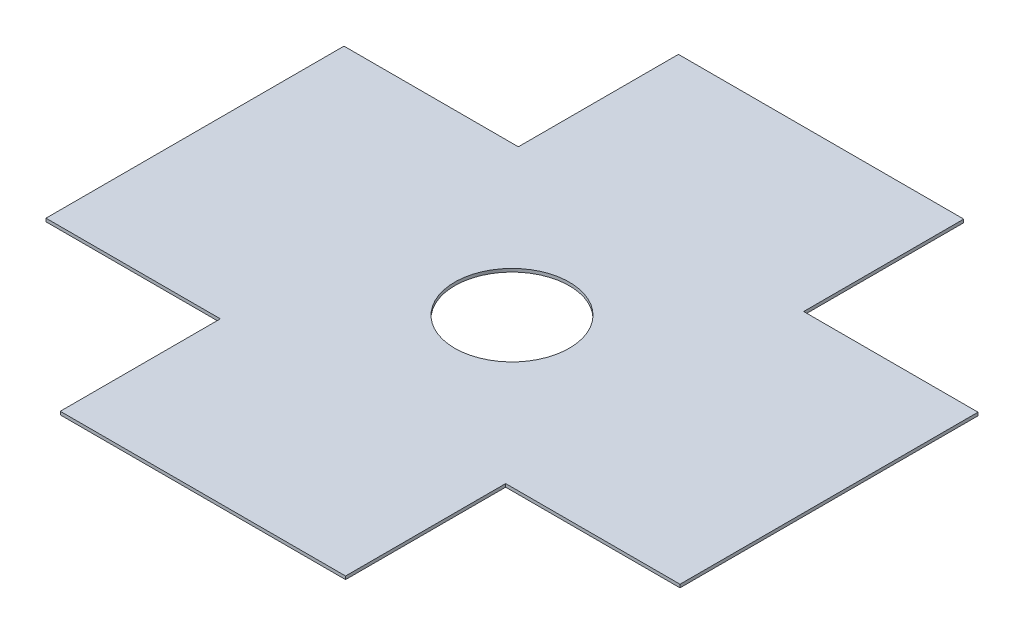
from build123d import *

# Parameters (mm, degrees)
BOSS_EXTRUDE1_DEPTH = 2
SKETCH2_R           = 36.15
CUT_EXTRUDE1_DEPTH  = 542.526676351
SKETCH3_R           = 10
BOSS_EXTRUDE2_DEPTH = 10


with BuildPart() as part:
    # Sketch1 → Boss-Extrude1 (new body)
    with BuildSketch(Plane.XZ.offset(167)):
        Polygon((279.299936853, -275.420908514), (389.299936853, -275.420908514), (389.299936853, -87.420908514), (279.299936853, -87.420908514), (279.299936853, 13.579091486), (99.299936853, 13.579091486), (99.299936853, -87.420908514), (-10.700063147, -87.420908514), (-10.700063147, -275.420908514), (99.299936853, -275.420908514), (99.299936853, -376.420908514), (279.299936853, -376.420908514), align=None)
    extrude(amount=-BOSS_EXTRUDE1_DEPTH)

    # Sketch2 → Cut-Extrude1 (cut, through all)
    with BuildSketch(Plane(origin=(0, -165, 0), x_dir=(1, 0, 0), z_dir=(0, 1, 0))):
        with Locations(Location((189.299936853, 181.420908514, 0), (0, 0, 270))):
            Circle(SKETCH2_R)
    extrude(amount=-CUT_EXTRUDE1_DEPTH, mode=Mode.SUBTRACT)

    # Sketch3 → Boss-Extrude2 (add)
    with BuildSketch(Plane.XZ.offset(167)):
        with Locations(Location((99.299936853, -110.952514015, 0), (0, 0, 90))):
            Circle(SKETCH3_R)
        with Locations(Location((279.299936853, -109.641474118, 0), (0, 0, 90))):
            Circle(SKETCH3_R)
        with Locations(Location((279.299936853, -253.20034291, 0), (0, 0, 90))):
            Circle(SKETCH3_R)
        with Locations(Location((99.299936853, -251.889303012, 0), (0, 0, 90))):
            Circle(SKETCH3_R)
    extrude(amount=BOSS_EXTRUDE2_DEPTH)


solid = part.part
